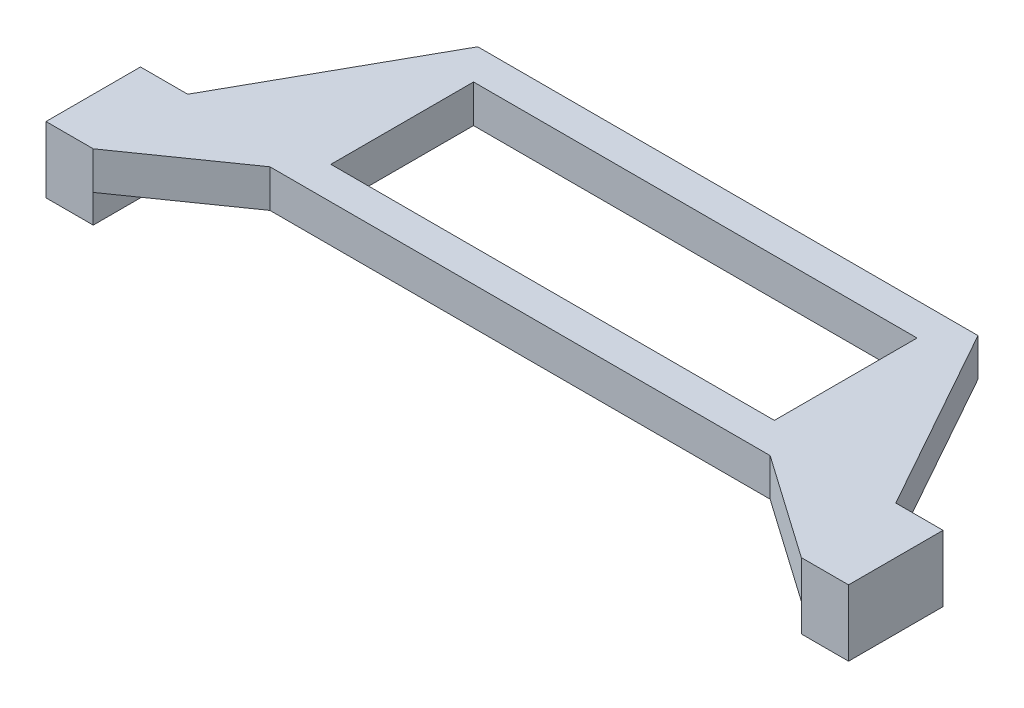
from build123d import *

# Parameters (mm, degrees)
SKETCH_1_W        = 5
SKETCH_1_H        = 10
EXTRUDE_1_DEPTH   = 7
EXTRUDE_1_2_DEPTH = 7
EXTRUDE_2_DEPTH   = 4


with BuildPart() as part:
    # Эскиз1 → Бобышка-Вытянуть1 (new body)
    with BuildSketch(Plane(origin=(0, 0, 0), x_dir=(1, 0, 0), z_dir=(0, 1, 0))):
        with Locations((-39.97, 5)):
            Rectangle(SKETCH_1_W, SKETCH_1_H)
    extrude(amount=EXTRUDE_1_DEPTH)



with BuildPart() as body_2:
    # Эскиз1 → Extrude 1 2 (new body)
    with BuildSketch(Plane(origin=(0, 0, 0), x_dir=(1, 0, 0), z_dir=(0, 1, 0))):
        with Locations((39.97, 5)):
            Rectangle(SKETCH_1_W, SKETCH_1_H)
    extrude(amount=EXTRUDE_1_2_DEPTH)


with BuildPart() as part_1:
    add(part.part)

    add(body_2.part)  # Бобышка-Вытянуть2 merges body 2
    # Эскиз2 → Бобышка-Вытянуть2 (add)
    with BuildSketch(Plane(origin=(0, 7, 0), x_dir=(1, 0, 0), z_dir=(0, 1, 0))):
        Polygon((0, 26.25), (0, 29.7), (-26.47, 29.7), (-26.47, 26.25), (-23.47, 26.25), align=None)
        Polygon((-26.47, 26.25), (-26.47, 29.7), (-37.47, 10), (-37.47, 0), (-26.47, 7.7), (-26.47, 11.15), (-23.47, 11.15), (-23.47, 26.25), align=None)
        Polygon((26.47, 26.25), (26.47, 29.7), (0, 29.7), (0, 26.25), (23.47, 26.25), align=None)
        Polygon((23.47, 11.15), (0, 11.15), (0, 7.7), (26.47, 7.7), (26.47, 11.15), align=None)
        Polygon((0, 7.7), (0, 11.15), (-23.47, 11.15), (-26.47, 11.15), (-26.47, 7.7), align=None)
        Polygon((37.47, 10), (26.47, 29.7), (26.47, 26.25), (23.47, 26.25), (23.47, 11.15), (26.47, 11.15), (26.47, 7.7), (37.47, 0), align=None)
    extrude(amount=-EXTRUDE_2_DEPTH)


solid = part_1.part
